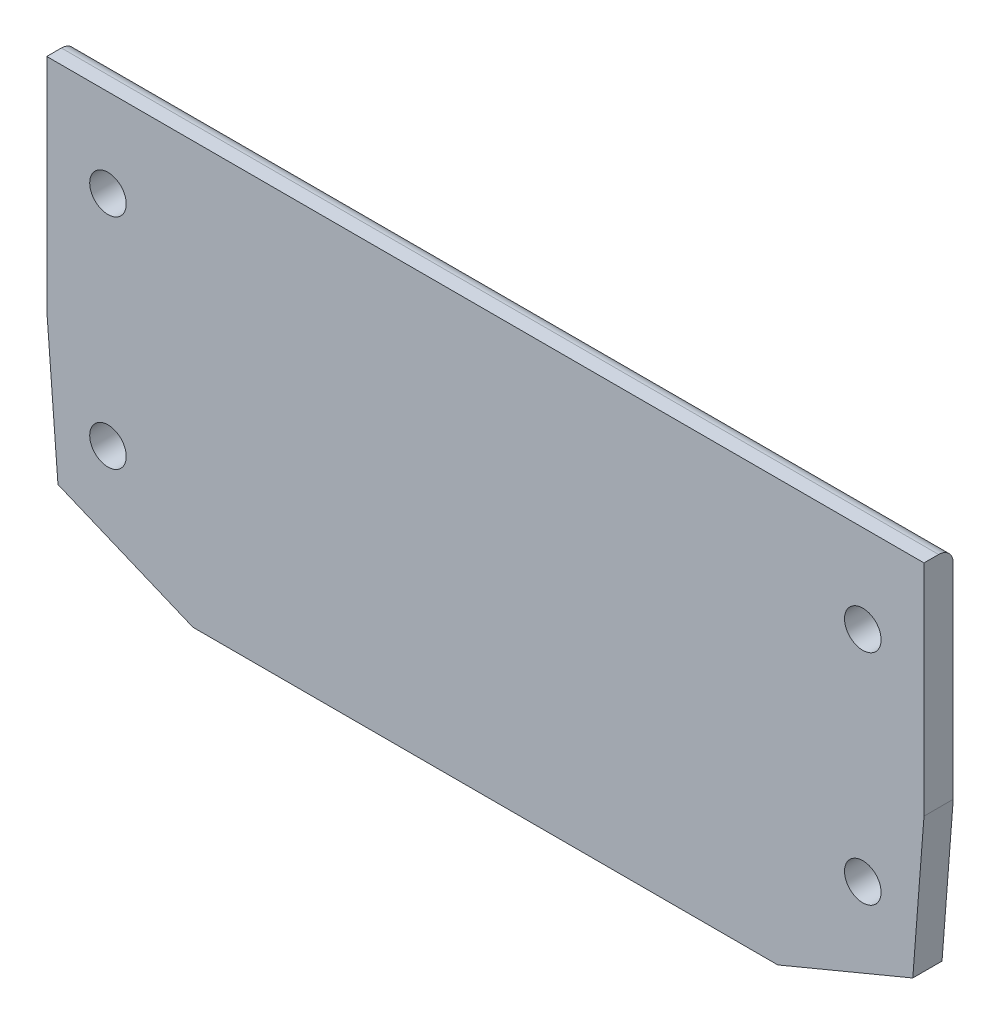
from build123d import *

# Parameters (mm, degrees)
BOSS_EXTRUDE1_DEPTH     = 2
SKETCH2_R               = 1.25
CUT_EXTRUDE1_DEPTH      = 2
MIRROR3_COPY_1_SKETCH_R = 1.25
MIRROR3_COPY_1_DEPTH    = 2
FILLET1_R               = 1


with BuildPart() as part:
    # Sketch1 → Boss-Extrude1 (new body)
    with BuildSketch(Plane.XY):
        Polygon((0.767190281, -24.970527522), (9.999292452, -28.813480749), (50.000707548, -28.813480749), (59.232809719, -24.970527522), (60, -15), (60, 0), (0, 0), (0, -15), align=None)
    extrude(amount=BOSS_EXTRUDE1_DEPTH)

    # Sketch2 → Cut-Extrude1 (cut)
    with BuildSketch(Plane(origin=(0, 0, 0), x_dir=(-1, 0, 0), z_dir=(0, 0, -1))):
        with Locations((-4.186666378, -20.978033438)):
            Circle(SKETCH2_R)
    cut_extrude1 = extrude(amount=-CUT_EXTRUDE1_DEPTH, mode=Mode.SUBTRACT)

    # Mirror2: Cut-Extrude1 across plane
    add(cut_extrude1.mirror(Plane(origin=(30, 0, 0), x_dir=(0, 0, 1), z_dir=(1, 0, 0))), mode=Mode.SUBTRACT)

    # Mirror3: Cut-Extrude1 across plane
    add(cut_extrude1.mirror(Plane.ZX.offset(-13.5)), mode=Mode.SUBTRACT)

    # Mirror3 copy 1 sketch → Mirror3 copy 1 (cut)
    with BuildSketch(Plane(origin=(60, -27, 0), x_dir=(1, 0, 0), z_dir=(0, 0, -1))):
        with Locations((-4.186666378, -20.978033438)):
            Circle(MIRROR3_COPY_1_SKETCH_R)
    extrude(amount=-MIRROR3_COPY_1_DEPTH, mode=Mode.SUBTRACT)

    # Fillet1
    fillet1_edges = [part.edges().sort_by_distance(p)[0] for p in [
        (30, 0, 0),
    ]]
    fillet(fillet1_edges, radius=FILLET1_R)


solid = part.part
